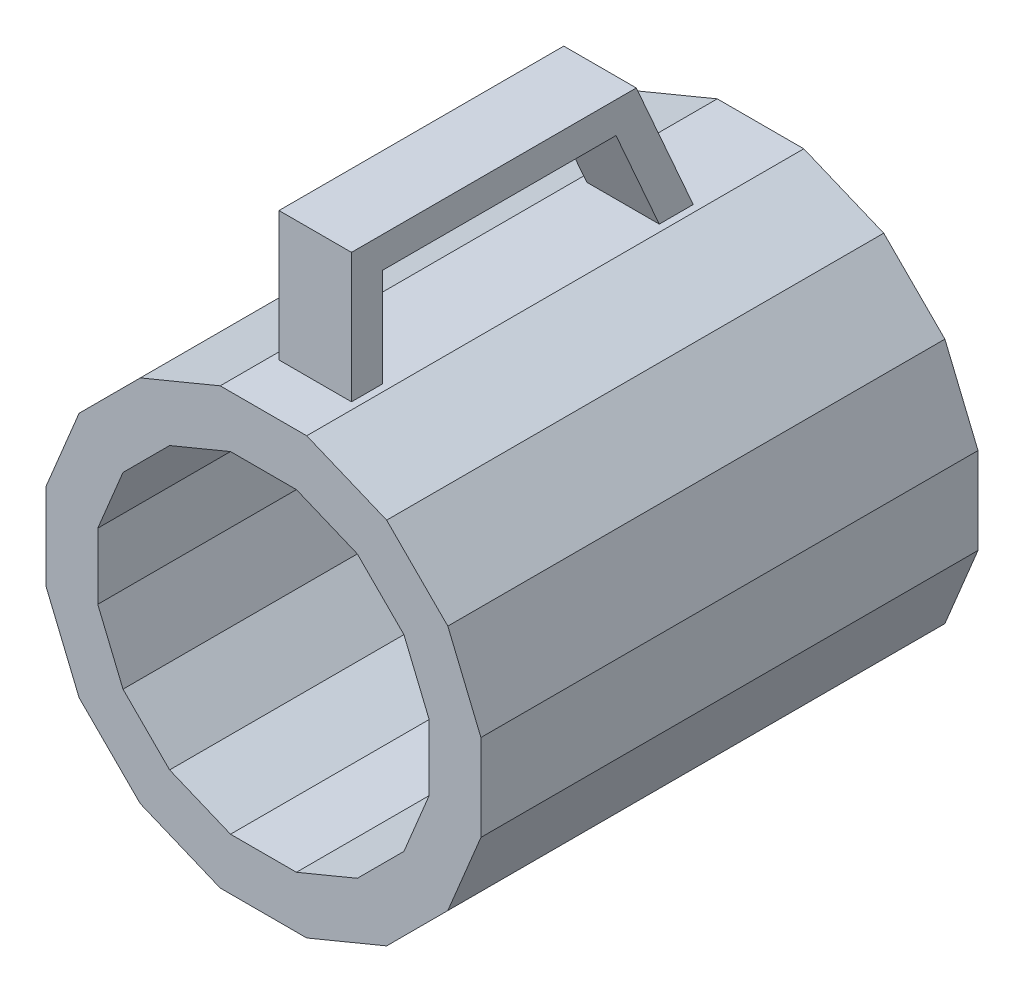
from build123d import *

# Parameters (mm, degrees)
BOSS_EXTRUDE1_DEPTH = 10
BOSS_EXTRUDE2_START = 10
BOSS_EXTRUDE2_DEPTH = 86
BOSS_EXTRUDE3_DEPTH = 7


with BuildPart() as part:
    # Sketch1 → Boss-Extrude1 (new body)
    # profile 1 of 2: a face of its own
    with BuildSketch(Plane.XY):
        Polygon((42, -8.35431943), (42, 8.35431943), (35.605880731, 23.791088889), (23.791088889, 35.605880731), (8.35431943, 42), (-8.35431943, 42), (-23.791088889, 35.605880731), (-35.605880731, 23.791088889), (-42, 8.35431943), (-42, -8.35431943), (-35.605880731, -23.791088889), (-23.791088889, -35.605880731), (-8.35431943, -42), (8.35431943, -42), (23.791088889, -35.605880731), (35.605880731, -23.791088889), align=None)
        Polygon((27.128290081, 18.126543915), (18.126543915, 27.128290081), (6.365195756, 32), (-6.365195756, 32), (-18.126543915, 27.128290081), (-27.128290081, 18.126543915), (-32, 6.365195756), (-32, -6.365195756), (-27.128290081, -18.126543915), (-18.126543915, -27.128290081), (-6.365195756, -32), (6.365195756, -32), (18.126543915, -27.128290081), (27.128290081, -18.126543915), (32, -6.365195756), (32, 6.365195756), align=None, mode=Mode.SUBTRACT)
    # profile 2 of 2: a face of its own
    with BuildSketch(Plane.XY):
        Polygon((32, 6.365195756), (27.128290081, 18.126543915), (18.126543915, 27.128290081), (6.365195756, 32), (-6.365195756, 32), (-18.126543915, 27.128290081), (-27.128290081, 18.126543915), (-32, 6.365195756), (-32, -6.365195756), (-27.128290081, -18.126543915), (-18.126543915, -27.128290081), (-6.365195756, -32), (6.365195756, -32), (18.126543915, -27.128290081), (27.128290081, -18.126543915), (32, -6.365195756), align=None)
    extrude(amount=BOSS_EXTRUDE1_DEPTH)

    # Sketch1<5> → Boss-Extrude2 (add)
    with BuildSketch(Plane.XY.offset(BOSS_EXTRUDE2_START)):
        Polygon((42, -8.35431943), (42, 8.35431943), (35.605880731, 23.791088889), (23.791088889, 35.605880731), (8.35431943, 42), (-8.35431943, 42), (-23.791088889, 35.605880731), (-35.605880731, 23.791088889), (-42, 8.35431943), (-42, -8.35431943), (-35.605880731, -23.791088889), (-23.791088889, -35.605880731), (-8.35431943, -42), (8.35431943, -42), (23.791088889, -35.605880731), (35.605880731, -23.791088889), align=None)
        Polygon((27.128290081, 18.126543915), (18.126543915, 27.128290081), (6.365195756, 32), (-6.365195756, 32), (-18.126543915, 27.128290081), (-27.128290081, 18.126543915), (-32, 6.365195756), (-32, -6.365195756), (-27.128290081, -18.126543915), (-18.126543915, -27.128290081), (-6.365195756, -32), (6.365195756, -32), (18.126543915, -27.128290081), (27.128290081, -18.126543915), (32, -6.365195756), (32, 6.365195756), align=None, mode=Mode.SUBTRACT)
    extrude(amount=BOSS_EXTRUDE2_DEPTH)

    # Sketch3 → Boss-Extrude3 (add, symmetric)
    with BuildSketch(Plane(origin=(0, 0, 0), x_dir=(0, 0, -1), z_dir=(1, 0, 0))):
        Polygon((-86, 42), (-86, 67), (-31, 67), (-20, 42), (-26.555120136, 42), (-34.915120136, 61), (-80, 61), (-80, 42), align=None)
    extrude(amount=BOSS_EXTRUDE3_DEPTH, both=True)


solid = part.part
